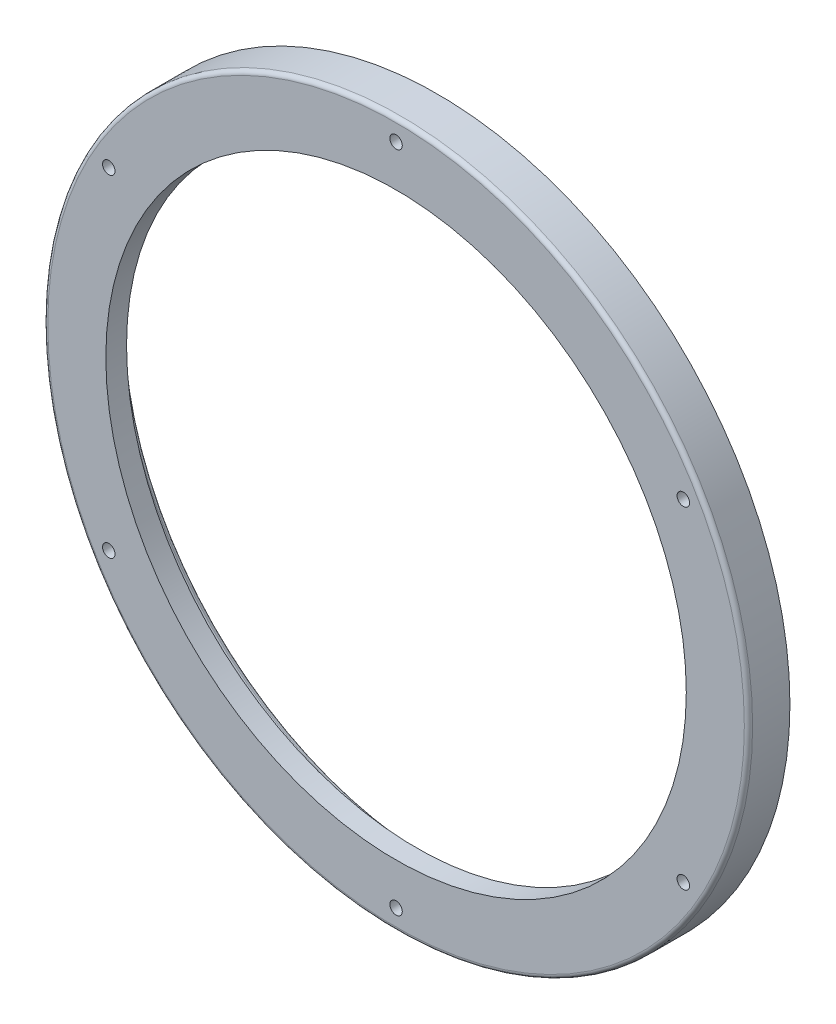
from build123d import *

# Parameters (mm, degrees)
SKETCH1_R           = 85
SKETCH1_R_2         = 70
BOSS_EXTRUDE1_DEPTH = 10
SKETCH2_R           = 75
CUT_EXTRUDE2_DEPTH  = 5
SKETCH3_R           = 1.5
CUT_EXTRUDE3_DEPTH  = 10
CIRPATTERN1_COUNT   = 6
FILLET1_R           = 1


with BuildPart() as part:
    # Sketch1 → Boss-Extrude1 (new body)
    with BuildSketch(Plane.XY):
        Circle(SKETCH1_R)
        Circle(SKETCH1_R_2, mode=Mode.SUBTRACT)
    extrude(amount=BOSS_EXTRUDE1_DEPTH)

    # Sketch2 → Cut-Extrude2 (cut)
    with BuildSketch(Plane.XY):
        Circle(SKETCH2_R)
    extrude(amount=CUT_EXTRUDE2_DEPTH, mode=Mode.SUBTRACT)

    # Sketch3 → Cut-Extrude3 (cut)
    with BuildSketch(Plane(origin=(0, 0, 0), x_dir=(-1, 0, 0), z_dir=(0, 0, -1))):
        with Locations((0, 80)):
            Circle(SKETCH3_R)
    cut_extrude3 = extrude(amount=-CUT_EXTRUDE3_DEPTH, mode=Mode.SUBTRACT)

    # CirPattern1: Cut-Extrude3 ×6 about axis
    cirpattern1_axis = Axis((0, 0, 0), (0, 0, 1))
    for i in range(1, CIRPATTERN1_COUNT):
        add(cut_extrude3.rotate(cirpattern1_axis, i * 360 / CIRPATTERN1_COUNT), mode=Mode.SUBTRACT)

    # Fillet1
    fillet1_edges = [part.edges().sort_by_distance(p)[0] for p in [
        (-75, 0, 0),
        (-85, 0, 10),
    ]]
    fillet(fillet1_edges, radius=FILLET1_R)


solid = part.part
